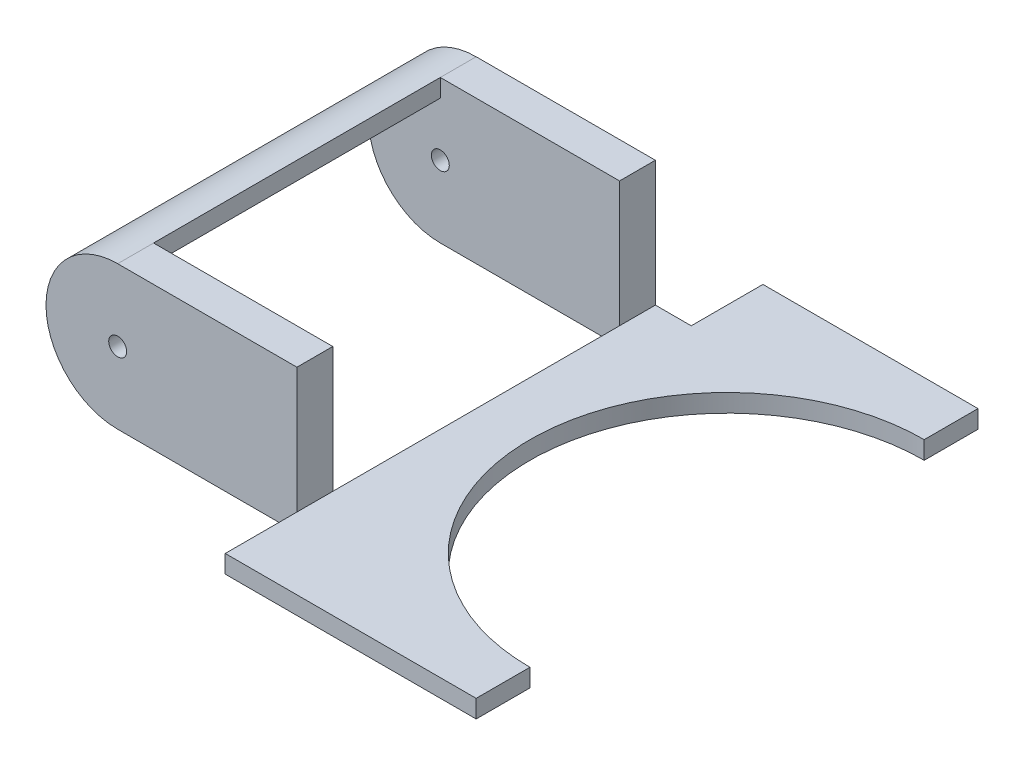
from build123d import *

# Parameters (mm, degrees)
EXTRUDE_1_DEPTH     = 100
SKETCH_2_R          = 2.5
CUT_EXTRUDE_1_DEPTH = 124.693168769
SKETCH_3_W          = 20
SKETCH_3_H          = 80
SKETCH_3_W_2        = 50
CUT_EXTRUDE_2_DEPTH = 35
SKETCH_4_W          = 70
SKETCH_4_H          = 100
CUT_EXTRUDE_3_DEPTH = 35
SKETCH_5_W          = 13.228756555
SKETCH_5_H          = 5
CUT_EXTRUDE_4_DEPTH = 124.693168769
SKETCH_7_R          = 2.5
CUT_EXTRUDE_5_DEPTH = 127.984250992
SKETCH_8_W          = 50
SKETCH_8_H          = 80.000000001
CUT_EXTRUDE_7_DEPTH = 20
SKETCH_10_W         = 20
SKETCH_10_H         = 100
EXTRUDE_6_DEPTH     = 5
SKETCH_11_W         = 70
SKETCH_11_H         = 20
EXTRUDE_7_DEPTH     = 5
SKETCH_12_W         = 70
SKETCH_12_H         = 20
EXTRUDE_8_DEPTH     = 5
SKETCH_13_R         = 55
CUT_EXTRUDE_8_DEPTH = 5
SKETCH_14_W         = 10
SKETCH_14_H         = 20
CUT_EXTRUDE_9_DEPTH = 5


with BuildPart() as part:
    # 草图1 → 凸台-拉伸1 (new body)
    with BuildSketch(Plane.XY):
        with BuildLine():
            Line((-50, 20), (50, 20))
            ThreePointArc((50, 20), (70, 0), (50, -20))
            Line((50, -20), (-50, -20))
            ThreePointArc((-50, -20), (-70, 0), (-50, 20))
        make_face()
    extrude(amount=EXTRUDE_1_DEPTH)

    # 草图2 → 切除-拉伸1 (cut, through all)
    with BuildSketch(Plane.XY.offset(100)):
        with Locations((-50, 0)):
            Circle(SKETCH_2_R)
    extrude(amount=-CUT_EXTRUDE_1_DEPTH, mode=Mode.SUBTRACT)

    # 草图3 → 切除-拉伸2 (cut)
    with BuildSketch(Plane.XZ.offset(20)):
        with Locations((-60, 50)):
            Rectangle(SKETCH_3_W, SKETCH_3_H)
        with Locations((-25, 50)):
            Rectangle(SKETCH_3_W_2, SKETCH_3_H)
    extrude(amount=-CUT_EXTRUDE_2_DEPTH, mode=Mode.SUBTRACT)

    # 草图4 → 切除-拉伸3 (cut)
    with BuildSketch(Plane(origin=(0, 20, 0), x_dir=(1, 0, 0), z_dir=(0, 1, 0))):
        with Locations((35, -50)):
            Rectangle(SKETCH_4_W, SKETCH_4_H)
    extrude(amount=-CUT_EXTRUDE_3_DEPTH, mode=Mode.SUBTRACT)

    # 草图5 → 切除-拉伸4 (cut, through all)
    with BuildSketch(Plane.XY.offset(100)):
        with Locations((56.614378278, -17.5)):
            Rectangle(SKETCH_5_W, SKETCH_5_H)
    extrude(amount=-CUT_EXTRUDE_4_DEPTH, mode=Mode.SUBTRACT)

    # 草图7 → 切除-拉伸5 (cut, through all)
    with BuildSketch(Plane(origin=(0, -15, 0), x_dir=(1, 0, 0), z_dir=(0, 1, 0))):
        with Locations(Location((35, -50, 0), (0, 0, 180))):
            Circle(SKETCH_7_R)
    extrude(amount=-CUT_EXTRUDE_5_DEPTH, mode=Mode.SUBTRACT)

    # 草图8 → 切除-拉伸7 (cut)
    with BuildSketch(Plane(origin=(0, 20, 0), x_dir=(1, 0, 0), z_dir=(0, 1, 0))):
        with Locations((-25, -50.000000001)):
            Rectangle(SKETCH_8_W, SKETCH_8_H)
    extrude(amount=-CUT_EXTRUDE_7_DEPTH, mode=Mode.SUBTRACT)

    # 草图10 → 凸台-拉伸6 (add)
    with BuildSketch(Plane(origin=(0, -15, 0), x_dir=(1, 0, 0), z_dir=(0, 1, 0))):
        with Locations((60, -50)):
            Rectangle(SKETCH_10_W, SKETCH_10_H)
    extrude(amount=-EXTRUDE_6_DEPTH)

    # 草图11 → 凸台-拉伸7 (add)
    with BuildSketch(Plane(origin=(0, -20, 0), x_dir=(-1, 0, 0), z_dir=(0, -1, 0))):
        with Locations((-35, 10)):
            Rectangle(SKETCH_11_W, SKETCH_11_H)
    extrude(amount=-EXTRUDE_7_DEPTH)

    # 草图12 → 凸台-拉伸8 (add)
    with BuildSketch(Plane.XZ.offset(20)):
        with Locations((35, 110)):
            Rectangle(SKETCH_12_W, SKETCH_12_H)
    extrude(amount=-EXTRUDE_8_DEPTH)

    # 草图13 → 切除-拉伸8 (cut)
    with BuildSketch(Plane.XZ.offset(20)):
        with Locations((70, 50)):
            Circle(SKETCH_13_R)
    extrude(amount=-CUT_EXTRUDE_8_DEPTH, mode=Mode.SUBTRACT)

    # 草图14 → 切除-拉伸9 (cut)
    with BuildSketch(Plane.XZ.offset(20)):
        with Locations((5, -10)):
            Rectangle(SKETCH_14_W, SKETCH_14_H)
    extrude(amount=-CUT_EXTRUDE_9_DEPTH, mode=Mode.SUBTRACT)


solid = part.part
